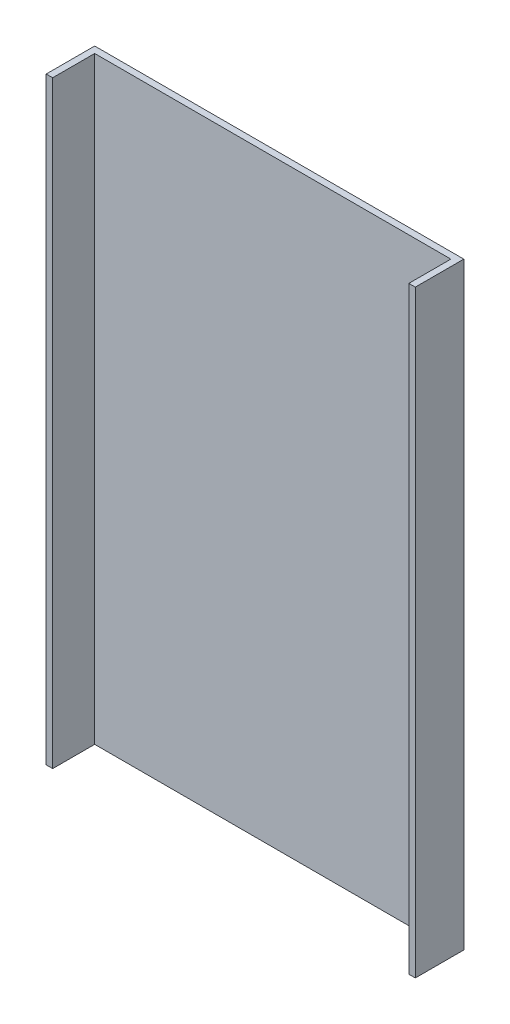
from build123d import *

# Parameters (mm, degrees)
SKETCH1_W           = 72.46
SKETCH1_H           = 117.46
BOSS_EXTRUDE1_DEPTH = 1.27
SKETCH2_W           = 1.27
SKETCH2_H           = 117.46
BOSS_EXTRUDE2_DEPTH = 8.25


with BuildPart() as part:
    # Sketch1 → Boss-Extrude1 (new body)
    with BuildSketch(Plane.XY):
        with Locations((36.23, 58.73)):
            Rectangle(SKETCH1_W, SKETCH1_H)
    extrude(amount=BOSS_EXTRUDE1_DEPTH)

    # Sketch2 → Boss-Extrude2 (add)
    with BuildSketch(Plane.XY.offset(1.27)):
        with Locations((0.635, 58.73)):
            Rectangle(SKETCH2_W, SKETCH2_H)
        with Locations((71.825, 58.73)):
            Rectangle(SKETCH2_W, SKETCH2_H)
    extrude(amount=BOSS_EXTRUDE2_DEPTH)


solid = part.part
